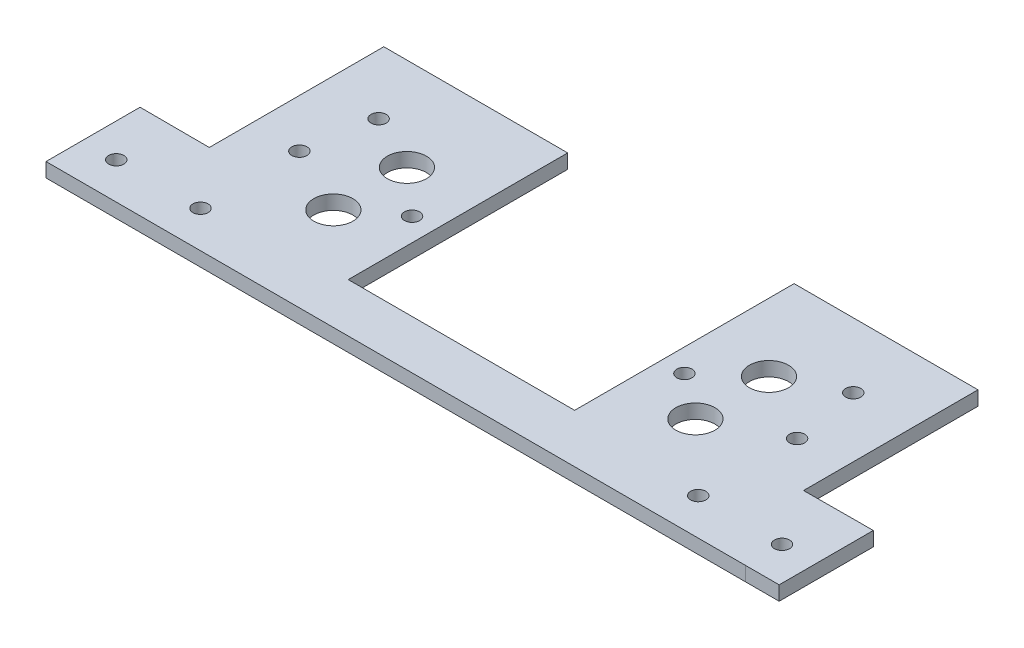
from build123d import *

# Parameters (mm, degrees)
SKETCH1_R           = 0.8382
SKETCH1_R_2         = 2.159
BOSS_EXTRUDE1_DEPTH = 1.575
SKETCH2_W           = 86.242658642
SKETCH2_H           = 6.602
CUT_EXTRUDE1_DEPTH  = 65.362755899
CUT_EXTRUDE2_DEPTH  = 60.755092082
CUT_EXTRUDE3_DEPTH  = 60.755092082
SKETCH6_R           = 0.8382
CUT_EXTRUDE4_DEPTH  = 2.54


with BuildPart() as part:
    # Sketch1 → Boss-Extrude1 (new body)
    with BuildSketch(Plane(origin=(0, 0, 0), x_dir=(1, 0, 0), z_dir=(0, 1, 0))):
        Polygon((44.351293299, -40.014412246), (37.136293299, -40.014412246), (37.136293299, -46.615946892), (29.968293307, -46.615946892), (-30.083706693, -46.615946892), (-36.433706701, -46.615946892), (-36.433706701, -40.014412246), (-43.648706701, -40.014412246), (-43.648706701, -30.885946892), (-43.648706701, -29.647946892), (-42.378706693, -29.615946892), (-32.472706701, -29.647946892), (-32.472706701, -10.370428445), (-12.155556701, -10.370428445), (-12.155556701, -34.615947016), (-11.557706701, -34.615947016), (12.260293299, -34.615947016), (12.858143299, -34.615947016), (12.858143299, -10.370428445), (33.175293299, -10.370428445), (33.175293299, -12.929386892), (33.175293299, -29.647946892), (38.746293307, -29.615946892), (42.351293307, -29.615946892), (44.351293299, -29.647946892), (44.351293299, -31.651946892), align=None)
        with Locations(Location((-36.433706701, -35.965946892, 0), (0, 0, 270))):
            Circle(SKETCH1_R, mode=Mode.SUBTRACT)
        with Locations(Location((37.136293299, -35.983946892, 0), (0, 0, 270))):
            Circle(SKETCH1_R, mode=Mode.SUBTRACT)
        with Locations(Location((-19.648556701, -28.76738335, 0), (0, 0, 270))):
            Circle(SKETCH1_R_2, mode=Mode.SUBTRACT)
        with Locations(Location((-19.648556701, -20.63938335, 0), (0, 0, 270))):
            Circle(SKETCH1_R_2, mode=Mode.SUBTRACT)
        with Locations(Location((20.351397299, -20.63938335, 0), (0, 0, 270))):
            Circle(SKETCH1_R_2, mode=Mode.SUBTRACT)
        with Locations(Location((20.351397299, -28.76738335, 0), (0, 0, 270))):
            Circle(SKETCH1_R_2, mode=Mode.SUBTRACT)
        with Locations(Location((-25.868706701, -17.547875601, 0), (0, 0, 270))):
            Circle(SKETCH1_R, mode=Mode.SUBTRACT)
        with Locations(Location((26.571293299, -17.547875601, 0), (0, 0, 270))):
            Circle(SKETCH1_R, mode=Mode.SUBTRACT)
    extrude(amount=BOSS_EXTRUDE1_DEPTH)

    # Sketch2 → Cut-Extrude1 (cut, through all)
    with BuildSketch(Plane.XZ):
        with Locations((-5.985036022, 43.314946892)):
            Rectangle(SKETCH2_W, SKETCH2_H)
    extrude(amount=-CUT_EXTRUDE1_DEPTH, mode=Mode.SUBTRACT)

    # Sketch3 → Cut-Extrude2 (cut, through all)
    with BuildSketch(Plane.XZ):
        Polygon((-40.148706701, 40.013946892), (-40.148706701, 29.623150607), (-34.773706693, 29.640513821), (-34.773706693, 8.975624969), (-46.772834391, 8.975624969), (-46.772834391, 40.013946892), align=None)
    extrude(amount=-CUT_EXTRUDE2_DEPTH, mode=Mode.SUBTRACT)

    # Sketch4 → Cut-Extrude3 (cut, through all)
    with BuildSketch(Plane.XZ):
        Polygon((40.851293299, 40.014412246), (40.851293299, 32.420104455), (40.851293299, 29.615946892), (35.476293307, 29.615946892), (35.476293307, 10.370428445), (54.710892309, 10.370428445), (54.710892309, 40.014412246), align=None)
    extrude(amount=-CUT_EXTRUDE3_DEPTH, mode=Mode.SUBTRACT)

    # Sketch6 → Cut-Extrude4 (cut)
    with BuildSketch(Plane(origin=(0, 0, 0), x_dir=(-1, 0, 0), z_dir=(0, -1, 0))):
        with Locations(Location((27.141556701, -35.947946892, 0), (0, 0, 90))):
            Circle(SKETCH6_R)
        with Locations(Location((27.141556701, -25.025946892, 0), (0, 0, 90))):
            Circle(SKETCH6_R)
        with Locations(Location((14.695556701, -25.025946892, 0), (0, 0, 90))):
            Circle(SKETCH6_R)
        with Locations(Location((-15.398143299, -25.025946892, 0), (0, 0, 90))):
            Circle(SKETCH6_R)
        with Locations(Location((-27.844397299, -25.025946892, 0), (0, 0, 90))):
            Circle(SKETCH6_R)
        with Locations(Location((-27.844397299, -35.947946892, 0), (0, 0, 90))):
            Circle(SKETCH6_R)
    extrude(amount=-CUT_EXTRUDE4_DEPTH, mode=Mode.SUBTRACT)


solid = part.part
